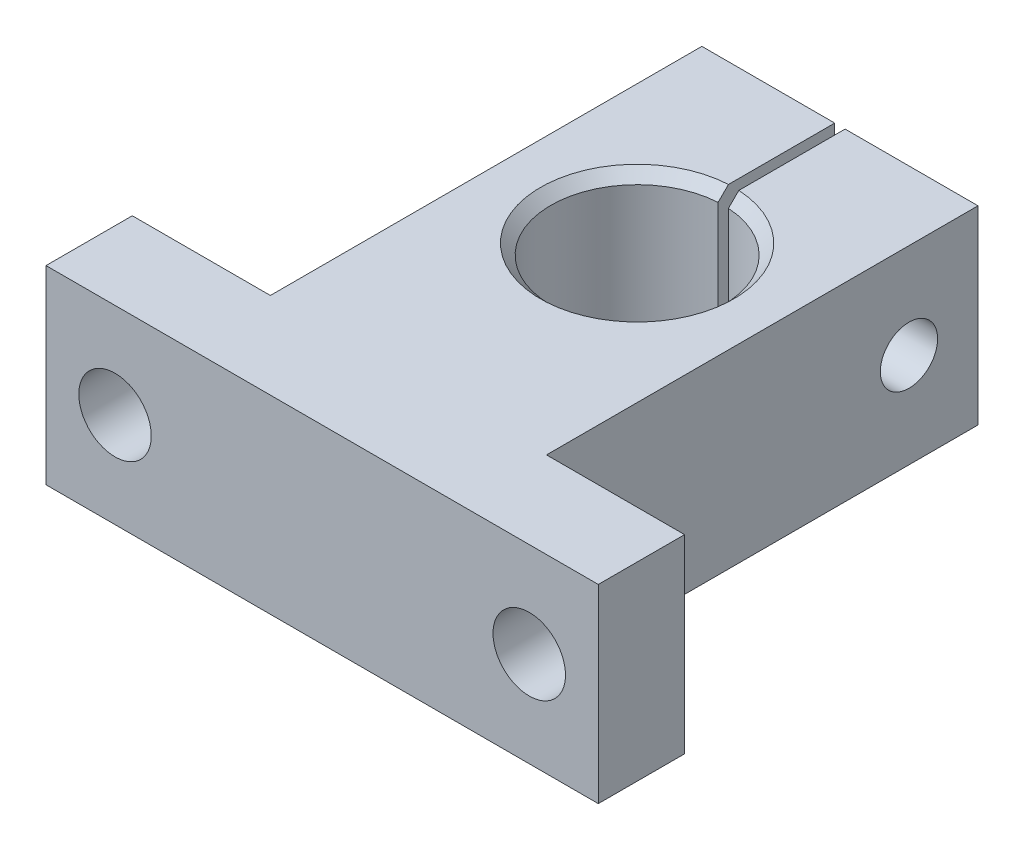
from build123d import *

# Parameters (mm, degrees)
BOSS_EXTRUDE1_DEPTH = 13.97
SKETCH2_R           = 2.667
CUT_EXTRUDE1_DEPTH  = 13.97
SKETCH3_R           = 3.81
CUT_EXTRUDE2_DEPTH  = 4.826
SKETCH4_R           = 2.1082
CUT_EXTRUDE3_DEPTH  = 17.272
CHAMFER1_SIZE       = 0.762


with BuildPart() as part:
    # Sketch1 → Boss-Extrude1 (new body)
    with BuildSketch(Plane(origin=(0, 0, 0), x_dir=(1, 0, 0), z_dir=(0, 1, 0))):
        with BuildLine():
            Line((10.16, 14.9225), (0.381, 14.9225))
            Line((0.381, 14.9225), (0.381, 6.338559694))
            ThreePointArc((0.381, 6.338559694), (0, -6.35), (-0.381, 6.338559694))
            Line((-0.381, 6.338559694), (-0.381, 14.9225))
            Line((-0.381, 14.9225), (-10.16, 14.9225))
            Line((-10.16, 14.9225), (-10.16, -16.8275))
            Line((-10.16, -16.8275), (-20.32, -16.8275))
            Line((-20.32, -16.8275), (-20.32, -23.1775))
            Line((-20.32, -23.1775), (20.32, -23.1775))
            Line((20.32, -23.1775), (20.32, -16.8275))
            Line((20.32, -16.8275), (10.16, -16.8275))
            Line((10.16, -16.8275), (10.16, 14.9225))
        make_face()
    extrude(amount=BOSS_EXTRUDE1_DEPTH)

    # Sketch2 → Cut-Extrude1 (cut)
    with BuildSketch(Plane(origin=(0, 0, 16.8275), x_dir=(-1, 0, 0), z_dir=(0, 0, -1))):
        with Locations((-15.24, 6.985)):
            Circle(SKETCH2_R)
        with Locations((15.24, 6.985)):
            Circle(SKETCH2_R)
    extrude(amount=-CUT_EXTRUDE1_DEPTH, mode=Mode.SUBTRACT)

    # Sketch3 → Cut-Extrude2 (cut)
    with BuildSketch(Plane.ZY.offset(10.16)):
        with Locations((-9.8425, 6.985)):
            Circle(SKETCH3_R)
    extrude(amount=-CUT_EXTRUDE2_DEPTH, mode=Mode.SUBTRACT)

    # Sketch4 → Cut-Extrude3 (cut)
    with BuildSketch(Plane.ZY.offset(5.334)):
        with Locations((-9.8425, 6.985)):
            Circle(SKETCH4_R)
    extrude(amount=-CUT_EXTRUDE3_DEPTH, mode=Mode.SUBTRACT)

    # Chamfer1
    chamfer1_edges = [part.edges().sort_by_distance(p)[0] for p in [
        (0, 0, 6.35),
        (0, 13.97, 6.35),
        (17.907, 6.985, 16.8275),
        (-12.573, 6.985, 16.8275),
        (-10.16, 6.985, -13.6525),
    ]]
    chamfer(chamfer1_edges, length=CHAMFER1_SIZE)


solid = part.part
